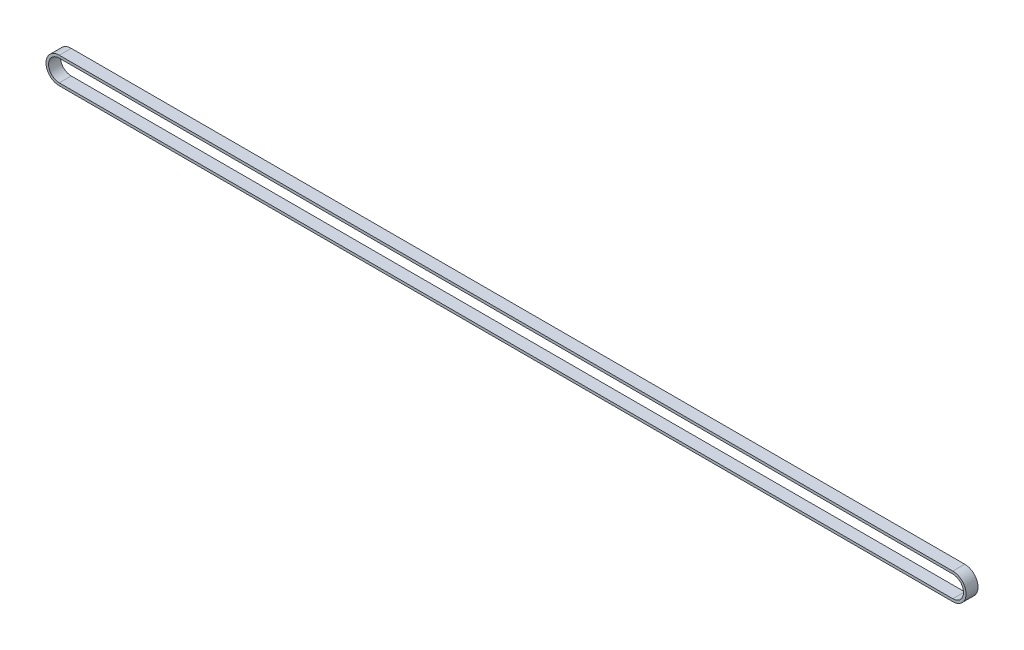
from build123d import *

# Parameters (mm, degrees)
BOSS_EXTRUDE1_DEPTH = 5


with BuildPart() as part:
    # Sketch1 → Boss-Extrude1 (new body)
    with BuildSketch(Plane.XY.offset(772.62174641)):
        with BuildLine():
            Line((131.506877487, -31.601821219), (505.506877487, -31.601821219))
            ThreePointArc((505.506877487, -31.601821219), (511.054245909, -26.054452798), (505.506877487, -20.507084377))
            Line((505.506877487, -20.507084377), (131.506877487, -20.507084377))
            ThreePointArc((131.506877487, -20.507084377), (125.959509066, -26.054452798), (131.506877487, -31.601821219))
        make_face()
        with BuildLine():
            Line((505.506877487, -30.528137009), (131.506877487, -30.528137009))
            ThreePointArc((131.506877487, -30.528137009), (127.033193277, -26.054452798), (131.506877487, -21.580768588))
            Line((131.506877487, -21.580768588), (505.506877487, -21.580768588))
            ThreePointArc((505.506877487, -21.580768588), (509.980561698, -26.054452798), (505.506877487, -30.528137009))
        make_face(mode=Mode.SUBTRACT)
    extrude(amount=-BOSS_EXTRUDE1_DEPTH)


solid = part.part
